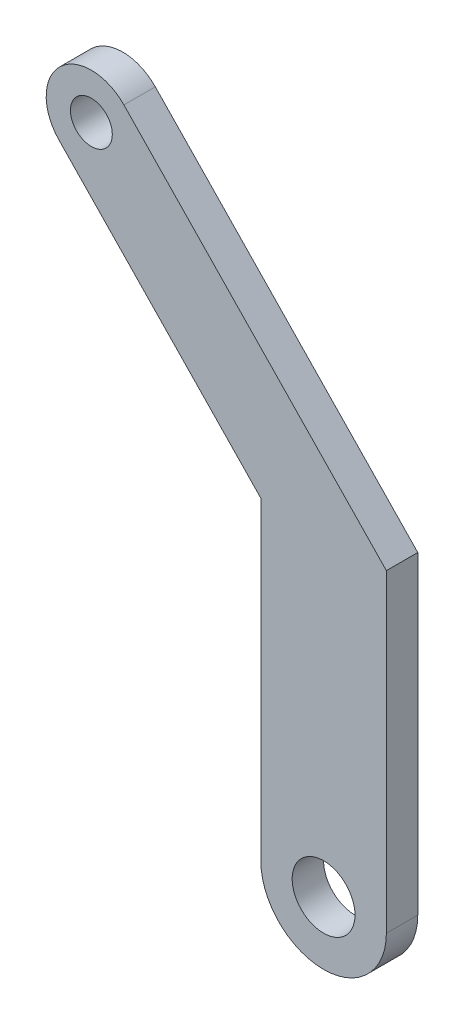
from build123d import *

# Parameters (mm, degrees)
SKETCH_1_R      = 15
SKETCH_1_R_2    = 10
EXTRUDE_1_DEPTH = 15


with BuildPart() as part:
    # 草图1 → 凸台-拉伸1 (new body)
    with BuildSketch(Plane.XY):
        with BuildLine():
            Line((-13.372283418, 0), (-13.372283418, 150))
            Line((-13.372283418, 150), (-109.841754926, 250))
            ThreePointArc((-109.841754926, 250), (-109.293148867, 280.529237365), (-78.763911502, 279.980631307))
            Line((-78.763911502, 279.980631307), (46.627716582, 150))
            Line((46.627716582, 150), (46.627716582, 0))
            ThreePointArc((46.627716582, 0), (16.627716582, -30), (-13.372283418, 0))
        make_face()
        with Locations((16.627716582, 0)):
            Circle(SKETCH_1_R, mode=Mode.SUBTRACT)
        with Locations((-94.302833214, 264.990315653)):
            Circle(SKETCH_1_R_2, mode=Mode.SUBTRACT)
    extrude(amount=EXTRUDE_1_DEPTH)


solid = part.part
